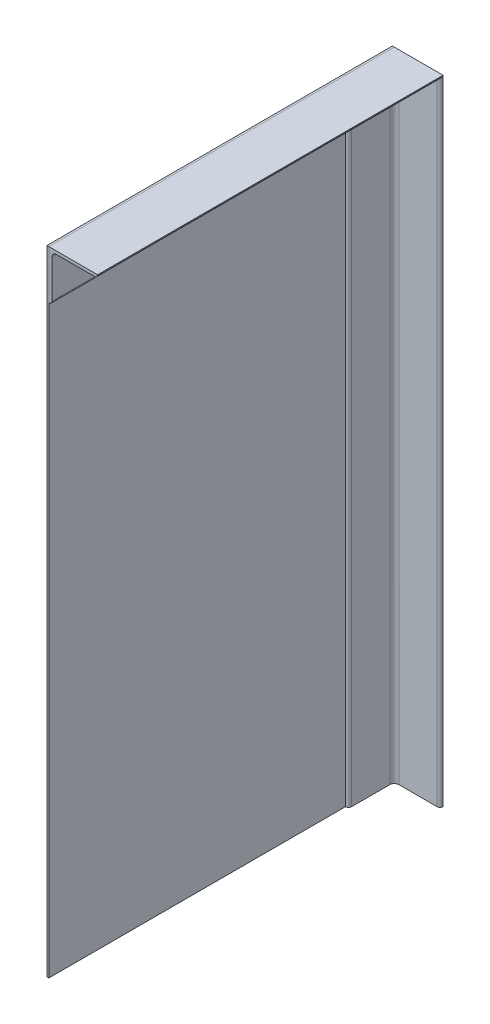
from build123d import *

# Parameters (mm, degrees)
HIERRO_ANGULAR_2_X_2_X_0_125_1_DEPTH        = 732.842048969
HIERRO_ANGULAR_2_X_2_X_0_125_1_2_DEPTH      = 360
HIERRO_ANGULAR_2_X_2_X_0_125_1_2_DEPTH_BACK = 72.842048969
CROQUIS2_W                                  = 360
CROQUIS2_H                                  = 660
SALIENTE_EXTRUIR1_DEPTH                     = 2


with BuildPart() as part:
    # Sketch1 on segment 1 (carried to segment 1) → Hierro angular 2 X 2 X 0.125(1) (new body)
    with BuildSketch(Plane.ZX.offset(-660)):
        with BuildLine():
            Line((0, 0), (0, 50.8))
            Line((0, 50.8), (0.00508, 50.8))
            ThreePointArc((0.00508, 50.8), (2.246551928, 49.871551928), (3.175, 47.63008))
            Line((3.175, 47.63008), (3.175, 7.9375))
            ThreePointArc((3.175, 7.9375), (4.569903955, 4.569903955), (7.9375, 3.175))
            Line((7.9375, 3.175), (47.63008, 3.175))
            ThreePointArc((47.63008, 3.175), (49.871551928, 2.246551928), (50.8, 0.00508))
            Line((50.8, 0.00508), (50.8, 0))
            Line((50.8, 0), (0, 0))
        make_face()
    extrude(amount=HIERRO_ANGULAR_2_X_2_X_0_125_1_DEPTH)

    # Hierro angular 2 X 2 X 0.125(1) mitre 1
    split(bisect_by=Plane(origin=(0, 0, 0), x_dir=(1, 0, 0), z_dir=(0, -0.707106781, -0.707106781)), keep=Keep.TOP)


with BuildPart() as body_2:
    # Sketch1 → Hierro angular 2 X 2 X 0.125_1 2 (new, two sides: drawn at the far end of the back side and taken through both)
    with BuildSketch(Plane(origin=(0, 0, 0), x_dir=(0, -1, 0), z_dir=(0, 0, 1)).offset(-HIERRO_ANGULAR_2_X_2_X_0_125_1_2_DEPTH_BACK)):
        with BuildLine():
            Line((0, 0), (0, 50.8))
            Line((0, 50.8), (0.00508, 50.8))
            ThreePointArc((0.00508, 50.8), (2.246551928, 49.871551928), (3.175, 47.63008))
            Line((3.175, 47.63008), (3.175, 7.9375))
            ThreePointArc((3.175, 7.9375), (4.569903955, 4.569903955), (7.9375, 3.175))
            Line((7.9375, 3.175), (47.63008, 3.175))
            ThreePointArc((47.63008, 3.175), (49.871551928, 2.246551928), (50.8, 0.00508))
            Line((50.8, 0.00508), (50.8, 0))
            Line((50.8, 0), (0, 0))
        make_face()
    extrude(amount=HIERRO_ANGULAR_2_X_2_X_0_125_1_2_DEPTH + HIERRO_ANGULAR_2_X_2_X_0_125_1_2_DEPTH_BACK)

    # Hierro angular 2 X 2 X 0.125_1 2 mitre 1
    split(bisect_by=Plane(origin=(0, 0, 0), x_dir=(-1, 0, 0), z_dir=(0, 0.707106781, 0.707106781)), keep=Keep.TOP)


with BuildPart() as body_3:
    # Croquis2 → Saliente-Extruir1 (new body)
    with BuildSketch(Plane.ZY):
        with Locations((180, -330)):
            Rectangle(CROQUIS2_W, CROQUIS2_H)
    extrude(amount=SALIENTE_EXTRUIR1_DEPTH)


solid = Compound([part.part, body_2.part, body_3.part])
